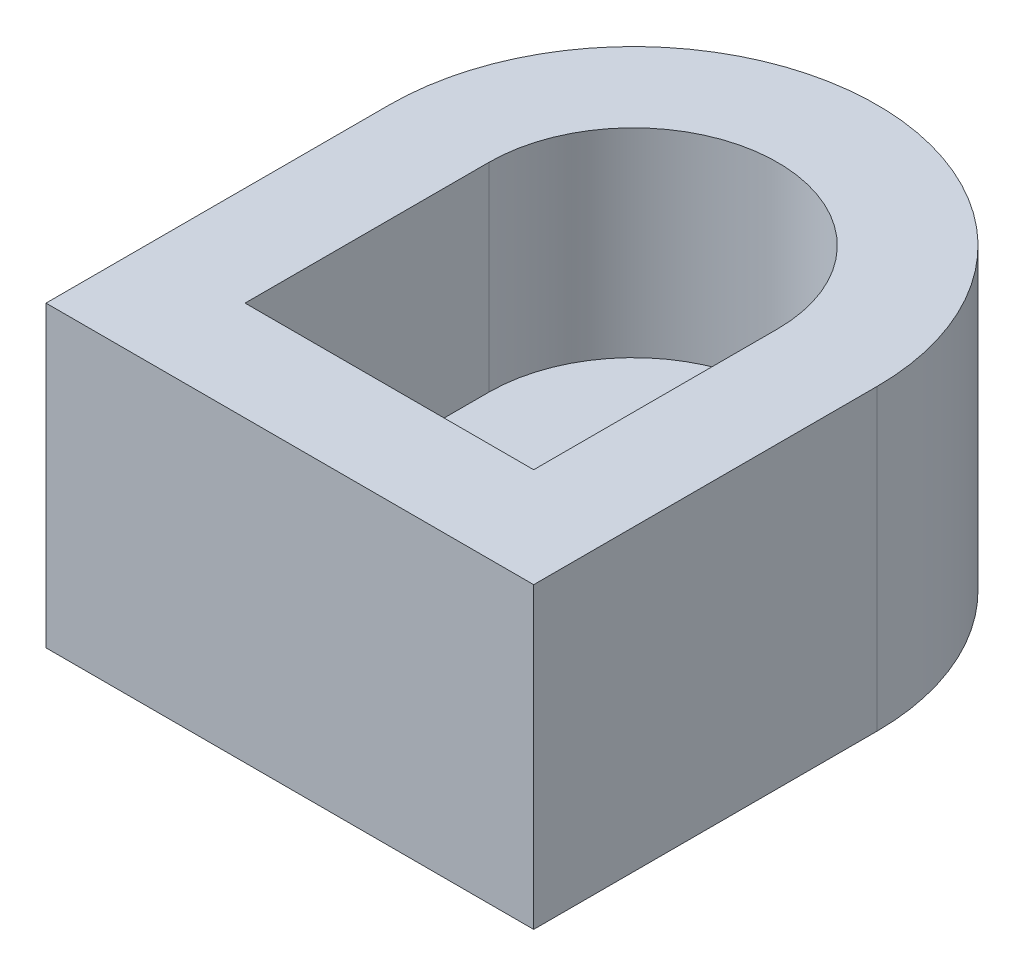
from build123d import *

# Parameters (mm, degrees)
BOSS_EXTRUDE1_DEPTH = 4
BOSS_EXTRUDE2_START = -2
BOSS_EXTRUDE2_DEPTH = 2


with BuildPart() as part:
    # Sketch1 → Boss-Extrude1 (new body)
    with BuildSketch(Plane(origin=(0, 0, 0), x_dir=(1, 0, 0), z_dir=(0, 1, 0))):
        with BuildLine():
            Line((4.9, -6.9), (4.9, 0))
            ThreePointArc((4.9, 0), (0, 4.9), (-4.9, 0))
            Line((-4.9, 0), (-4.9, -6.9))
            Line((-4.9, -6.9), (4.9, -6.9))
        make_face()
        with BuildLine():
            ThreePointArc((-2.9, 0), (0, 2.9), (2.9, 0))
            Line((2.9, 0), (2.9, -4.9))
            Line((2.9, -4.9), (-2.9, -4.9))
            Line((-2.9, -4.9), (-2.9, 0))
        make_face(mode=Mode.SUBTRACT)
    extrude(amount=BOSS_EXTRUDE1_DEPTH)

    # Sketch1<3> → Boss-Extrude2 (add)
    with BuildSketch(Plane(origin=(0, 0, 0), x_dir=(1, 0, 0), z_dir=(0, 1, 0)).offset(BOSS_EXTRUDE2_START)):
        with BuildLine():
            ThreePointArc((4.9, 0), (0, 4.9), (-4.9, 0))
            Line((-4.9, 0), (-4.9, -6.9))
            Line((-4.9, -6.9), (4.9, -6.9))
            Line((4.9, -6.9), (4.9, 0))
        make_face()
    extrude(amount=BOSS_EXTRUDE2_DEPTH)


solid = part.part
